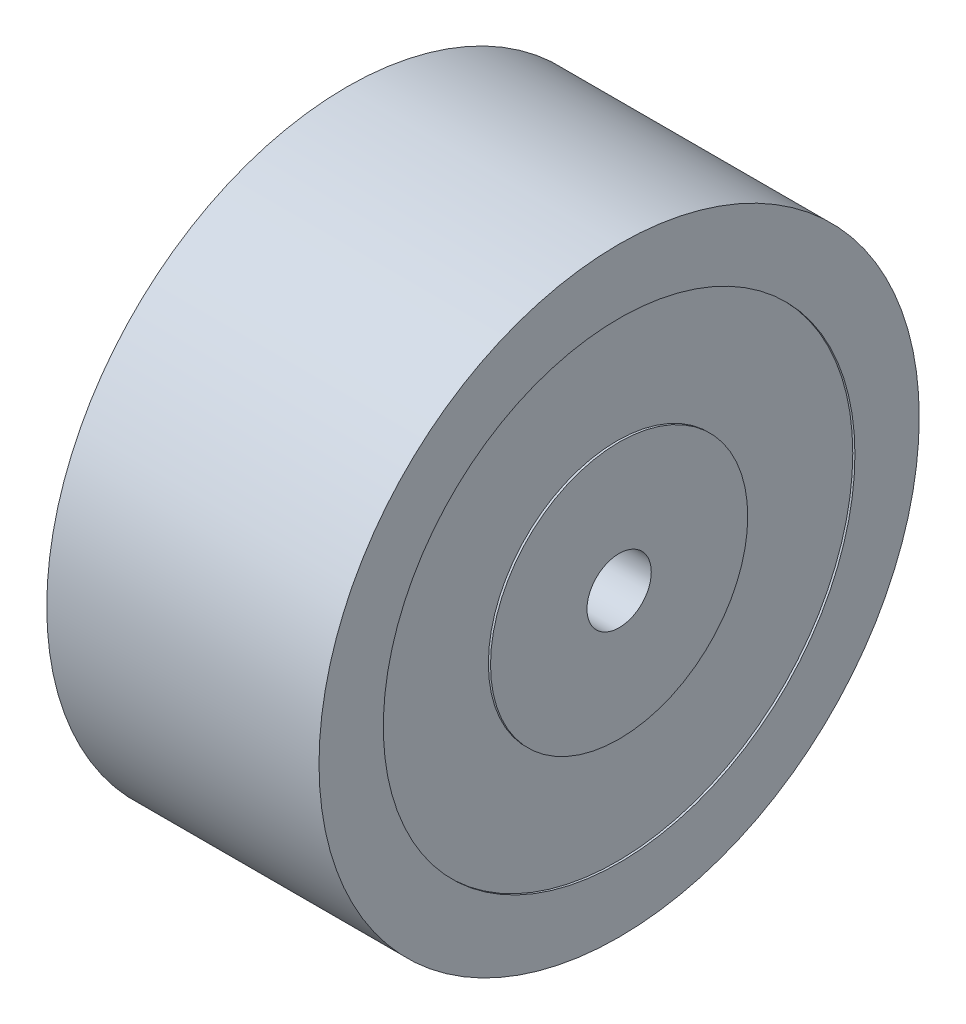
from build123d import *


with BuildPart() as part:
    # Esquisse1 → Révolution1 (revolve)
    with BuildSketch(Plane.XY):
        Polygon((-12.7, 14), (0, 14), (0, 11), (-0.1, 11), (-0.1, 6), (0, 6), (0, 1.5), (-4.6, 1.5), (-4.6, 9), (-12.6, 9), (-12.6, 11), (-12.7, 11), align=None)
    revolve(axis=Axis((20.169702695, 0, 0), (-1, 0, 0)))


solid = part.part
